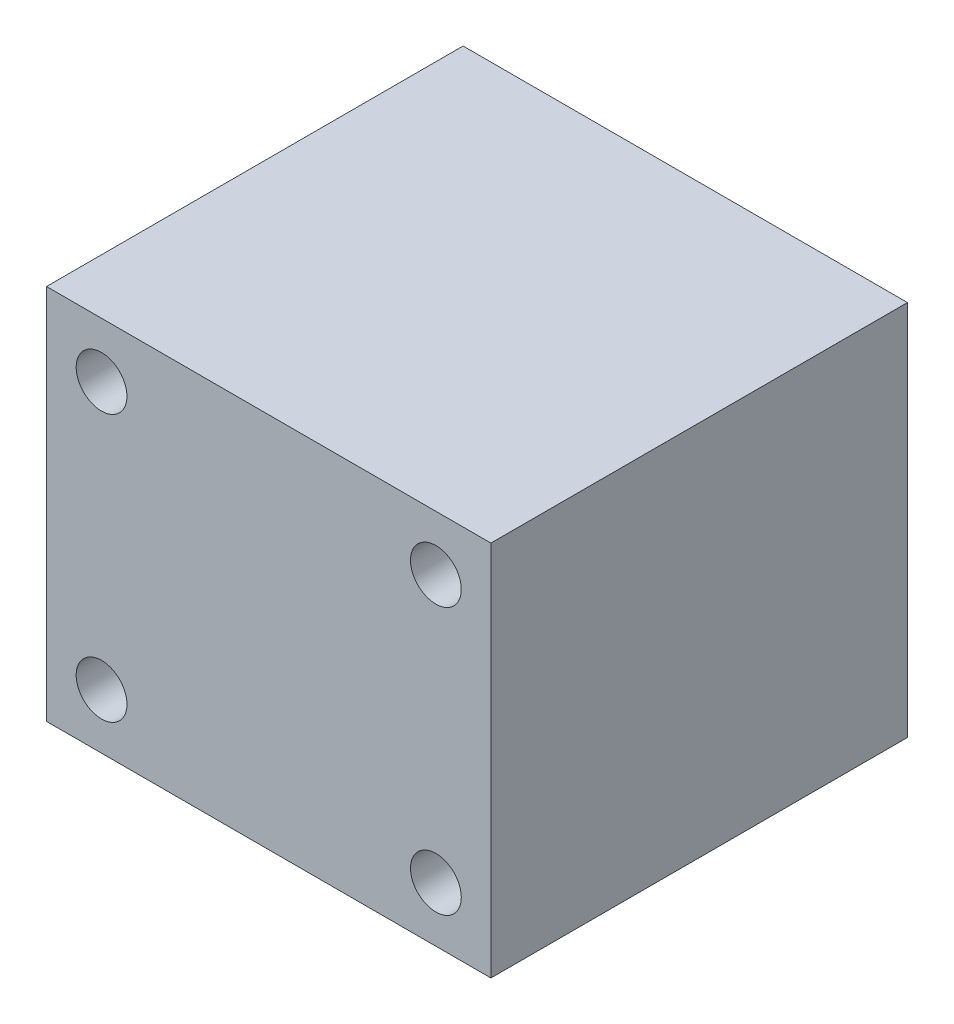
from build123d import *

# Parameters (mm, degrees)
SKETCH1_W           = 26.67
SKETCH1_H           = 22.606
SKETCH1_R           = 1.524
BOSS_EXTRUDE2_DEPTH = 25


with BuildPart() as part:
    # Sketch1 → Boss-Extrude2 (new body)
    with BuildSketch(Plane.XY):
        Rectangle(SKETCH1_W, SKETCH1_H)
        with Locations((10.033, -8.001)):
            Circle(SKETCH1_R, mode=Mode.SUBTRACT)
        with Locations(Location((10.033, 8.001, 0), (0, 0, 180))):
            Circle(SKETCH1_R, mode=Mode.SUBTRACT)
        with Locations(Location((-10.033, 8.001, 0), (0, 0, 180))):
            Circle(SKETCH1_R, mode=Mode.SUBTRACT)
        with Locations((-10.033, -8.001)):
            Circle(SKETCH1_R, mode=Mode.SUBTRACT)
    extrude(amount=BOSS_EXTRUDE2_DEPTH)


solid = part.part
